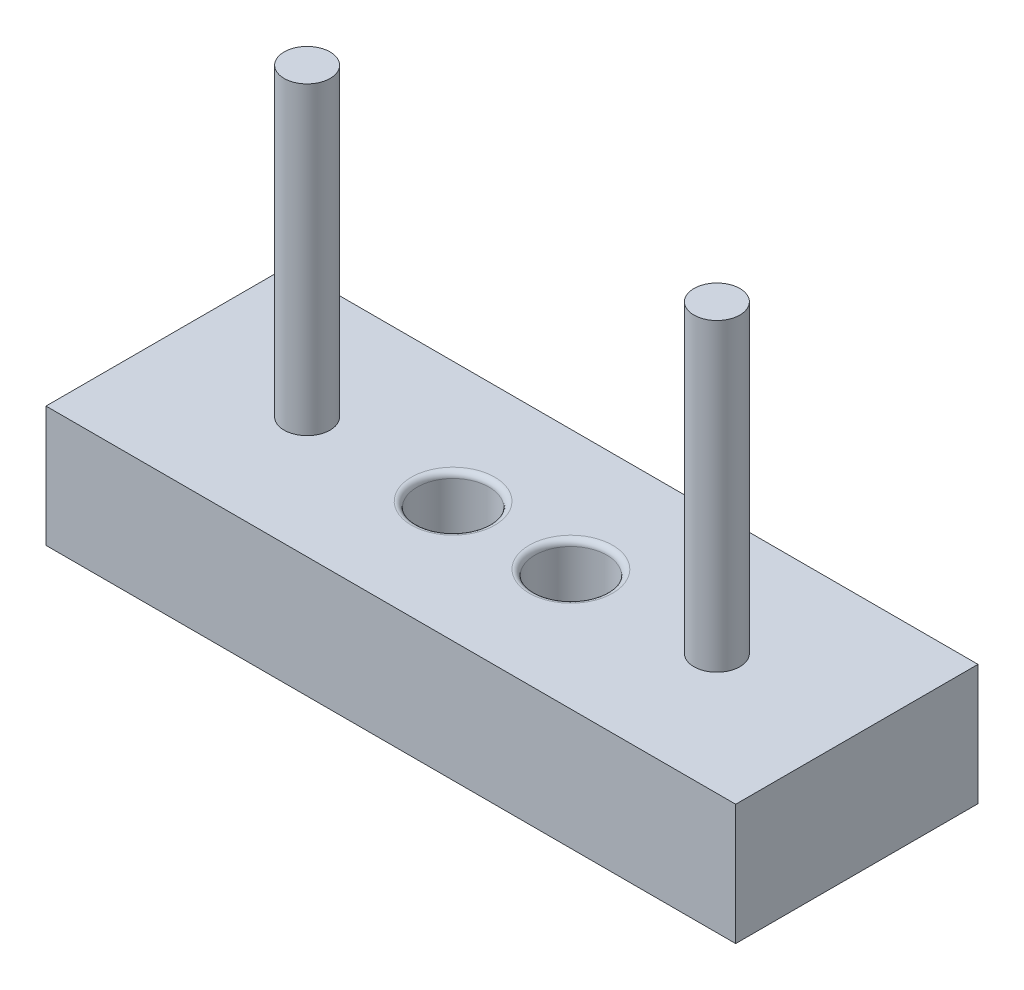
from build123d import *

# Parameters (mm, degrees)
SKETCH1_W           = 120
SKETCH1_H           = 42.16
BOSS_EXTRUDE1_DEPTH = 21
SKETCH2_R           = 6.25
CUT_EXTRUDE1_DEPTH  = 14
SKETCH3_R           = 3.25
CUT_EXTRUDE2_DEPTH  = 82.007752785
FILLET1_R           = 1
FILLET2_R           = 0.5
SKETCH4_R           = 4
BOSS_EXTRUDE2_DEPTH = 53


with BuildPart() as part:
    # Sketch1 → Boss-Extrude1 (new body)
    with BuildSketch(Plane(origin=(0, 0, 0), x_dir=(1, 0, 0), z_dir=(0, 1, 0))):
        with Locations((16.811029237, -0.514485382)):
            Rectangle(SKETCH1_W, SKETCH1_H)
    extrude(amount=BOSS_EXTRUDE1_DEPTH)

    # Sketch2 → Cut-Extrude1 (cut)
    with BuildSketch(Plane(origin=(0, 21, 0), x_dir=(1, 0, 0), z_dir=(0, 1, 0))):
        with Locations((27.061029237, -0.514485382)):
            Circle(SKETCH2_R)
        with Locations((6.561029237, -0.514485382)):
            Circle(SKETCH2_R)
    extrude(amount=-CUT_EXTRUDE1_DEPTH, mode=Mode.SUBTRACT)

    # Sketch3 → Cut-Extrude2 (cut, through all)
    with BuildSketch(Plane(origin=(0, 7, 0), x_dir=(1, 0, 0), z_dir=(0, 1, 0))):
        with Locations((27.061029237, -0.514485382)):
            Circle(SKETCH3_R)
        with Locations((6.561029237, -0.514485382)):
            Circle(SKETCH3_R)
    extrude(amount=-CUT_EXTRUDE2_DEPTH, mode=Mode.SUBTRACT)

    # Fillet1
    fillet1_edges = [part.edges().sort_by_distance(p)[0] for p in [
        (0.311029237, 21, 0.514485382),
        (20.811029237, 21, 0.514485382),
    ]]
    fillet(fillet1_edges, radius=FILLET1_R)

    # Fillet2
    fillet2_edges = [part.edges().sort_by_distance(p)[0] for p in [
        (3.311029237, 0, 0.514485382),
        (23.811029237, 0, 0.514485382),
    ]]
    fillet(fillet2_edges, radius=FILLET2_R)

    # Sketch4 → Boss-Extrude2 (add)
    with BuildSketch(Plane(origin=(0, 21, 0), x_dir=(1, 0, 0), z_dir=(0, 1, 0))):
        with Locations((52.461029237, -0.514485382)):
            Circle(SKETCH4_R)
        with Locations((-18.838970763, -0.514485382)):
            Circle(SKETCH4_R)
    extrude(amount=BOSS_EXTRUDE2_DEPTH)


solid = part.part
